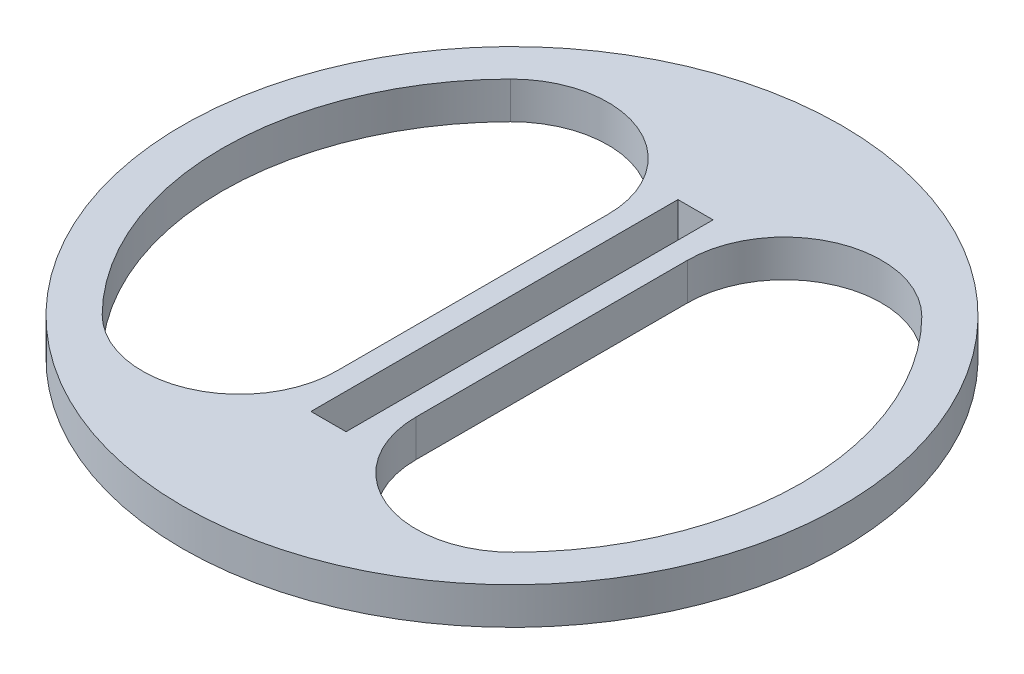
from build123d import *

# Parameters (mm, degrees)
SKETCH1_R           = 35.65
SKETCH1_W           = 3.8
SKETCH1_H           = 39.7
BOSS_EXTRUDE1_DEPTH = 4
FILLET1_R           = 10.5


with BuildPart() as part:
    # Sketch1 → Boss-Extrude1 (new body)
    with BuildSketch(Plane(origin=(0, 0, 0), x_dir=(1, 0, 0), z_dir=(0, 1, 0))):
        with Locations(Location((0, 0, 0), (0, 0, 270))):
            Circle(SKETCH1_R)
        with BuildLine():
            Line((4.3, -31.053703483), (4.3, 31.053703483))
            ThreePointArc((4.3, 31.053703483), (31.35, 0), (4.3, -31.053703483))
        make_face(mode=Mode.SUBTRACT)
        with BuildLine():
            Line((-4.3, -31.053703483), (-4.3, 31.053703483))
            ThreePointArc((-4.3, 31.053703483), (-31.35, 0), (-4.3, -31.053703483))
        make_face(mode=Mode.SUBTRACT)
        Rectangle(SKETCH1_W, SKETCH1_H, mode=Mode.SUBTRACT)
    extrude(amount=BOSS_EXTRUDE1_DEPTH)

    # Fillet1
    fillet1_edges = [part.edges().sort_by_distance(p)[0] for p in [
        (4.3, 2, -31.053703483),
        (4.3, 2, 31.053703483),
        (-4.3, 2, 31.053703483),
        (-4.3, 2, -31.053703483),
    ]]
    fillet(fillet1_edges, radius=FILLET1_R)


solid = part.part
